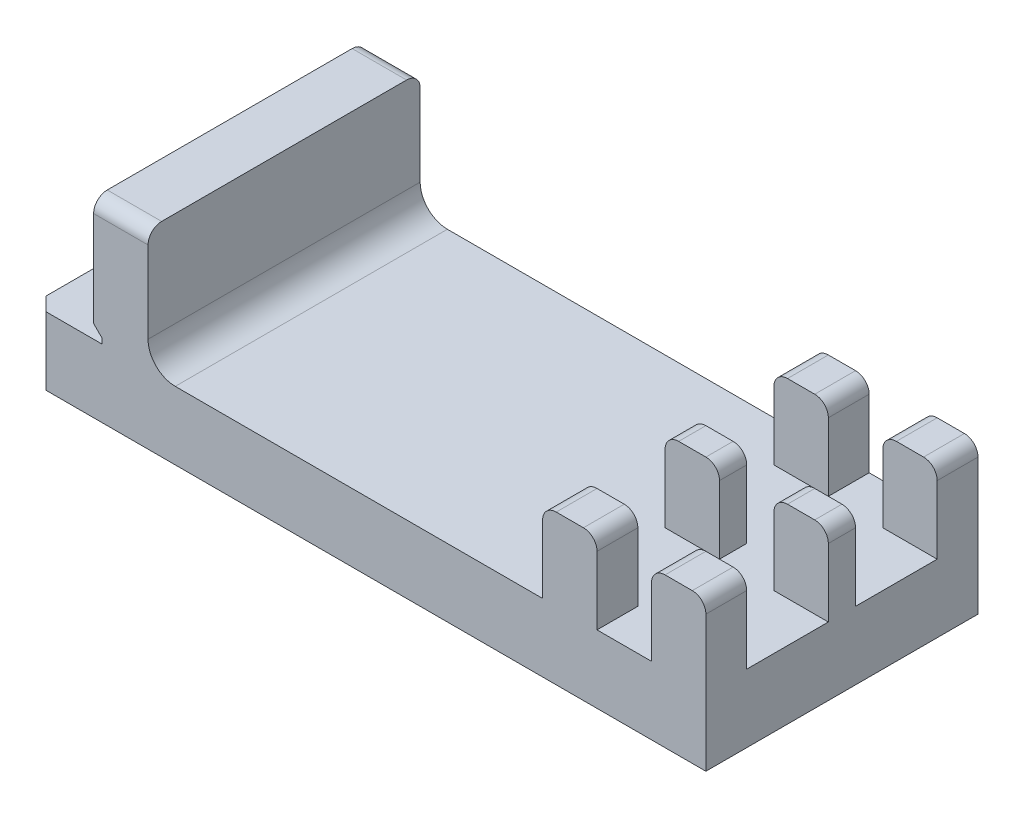
from build123d import *

# Parameters (mm, degrees)
P_IDAT_VYSUNUT_M1_DEPTH  = 10
SKICA2_W                 = 12
SKICA2_H                 = 6
ODEBRAT_VYSUNUT_M1_DEPTH = 6
ZAOBLIT1_R               = 1
ZKOSEN_1_SIZE            = 1
ZAOBLIT2_R               = 2
ODEBRAT_VYSUNUT_M2_DEPTH = 56.192843739


with BuildPart() as part:
    # Skica1 → Přidat vysunutím1 (new, symmetric)
    with BuildSketch(Plane.XY):
        Polygon((-49.5, 0), (0, 0), (0, 11), (-4, 11), (-4, 5), (-8, 5), (-8, 11), (-12, 11), (-12, 5), (-41, 5), (-41, 14), (-45, 14), (-45, 5), (-49.5, 5), align=None)
    extrude(amount=P_IDAT_VYSUNUT_M1_DEPTH, both=True)

    # Skica2 → Odebrat vysunutím1 (cut)
    with BuildSketch(Plane(origin=(0, 11, 0), x_dir=(1, 0, 0), z_dir=(0, 1, 0))):
        with Locations((-6, 4)):
            Rectangle(SKICA2_W, SKICA2_H)
        with Locations((-6, -4)):
            Rectangle(SKICA2_W, SKICA2_H)
    extrude(amount=-ODEBRAT_VYSUNUT_M1_DEPTH, mode=Mode.SUBTRACT)

    # Zaoblit1
    zaoblit1_edges = [part.edges().sort_by_distance(p)[0] for p in [
        (-43, 14, -10),
        (-12, 11, 8.5),
        (-8, 11, 8.5),
        (-4, 11, 8.5),
        (0, 11, 8.5),
        (-8, 11, 0),
        (-8, 11, -8.5),
        (-4, 11, 0),
        (-4, 11, -8.5),
        (-43, 14, 10),
        (0, 11, 0),
        (0, 11, -8.5),
        (-12, 11, 0),
        (-12, 11, -8.5),
    ]]
    fillet(zaoblit1_edges, radius=ZAOBLIT1_R)

    # Zkosení1
    zkosen_1_edges = [part.edges().sort_by_distance(p)[0] for p in [
        (-49.5, 2.5, -10),
        (-49.5, 2.5, 10),
    ]]
    chamfer(zkosen_1_edges, length=ZKOSEN_1_SIZE)

    # Zaoblit2
    zaoblit2_edges = [part.edges().sort_by_distance(p)[0] for p in [
        (-41, 5, 0),
    ]]
    fillet(zaoblit2_edges, radius=ZAOBLIT2_R)

    # Skica3 → Odebrat vysunutím2 (cut, through all)
    with BuildSketch(Plane.XY.offset(10)):
        Polygon((-45, 6), (-44.4, 5.4), (-44.4, 5), (-45, 5), align=None)
    extrude(amount=-ODEBRAT_VYSUNUT_M2_DEPTH, mode=Mode.SUBTRACT)


solid = part.part
